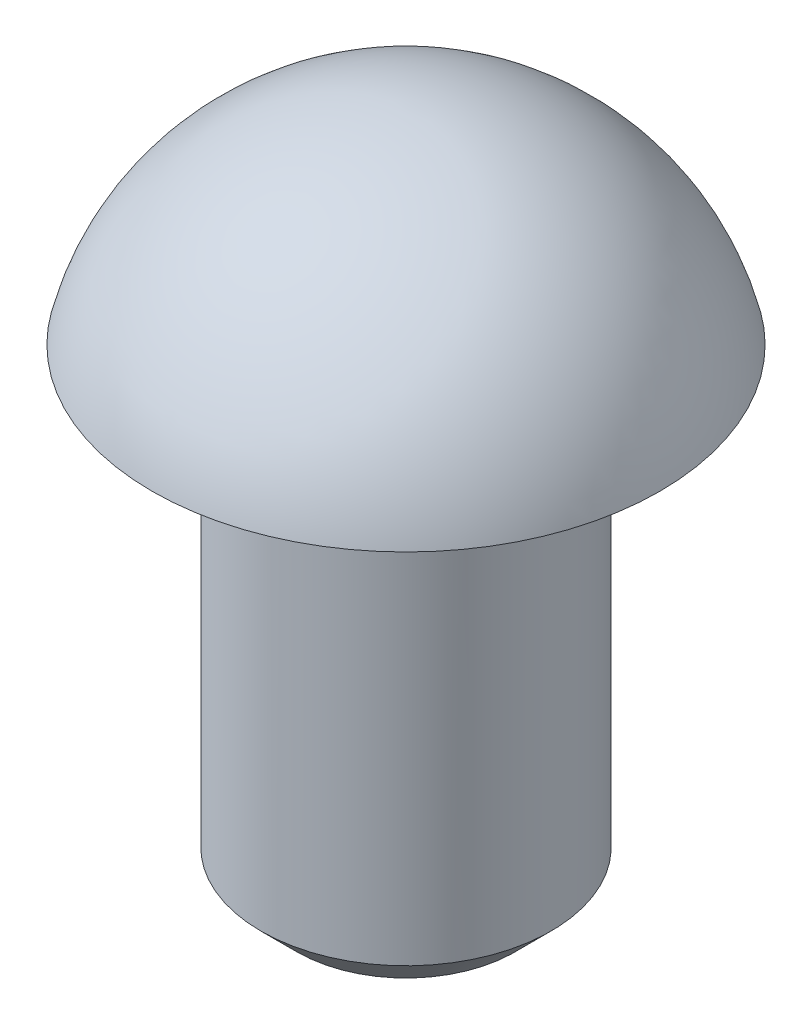
from build123d import *

# Parameters (mm, degrees)
SKETCH1_R           = 2
BOSS_EXTRUDE1_DEPTH = 3.25
CHAMFER1_SIZE       = 0.5


with BuildPart() as part:
    # Sketch1 → Boss-Extrude1 (new, symmetric)
    with BuildSketch(Plane(origin=(0, 0, 0), x_dir=(1, 0, 0), z_dir=(0, 1, 0))):
        with Locations(Location((0, 0, 0), (0, 0, 90))):
            Circle(SKETCH1_R)
    extrude(amount=BOSS_EXTRUDE1_DEPTH, both=True)

    # Chamfer1
    chamfer1_edges = [part.edges().sort_by_distance(p)[0] for p in [
        (0, -3.25, 2),
    ]]
    chamfer(chamfer1_edges, length=CHAMFER1_SIZE)

    # Sketch2 → Revolve1 (revolve)
    with BuildSketch(Plane(origin=(0, 0, 0), x_dir=(0, 0, -1), z_dir=(1, 0, 0))):
        with BuildLine():
            Line((0, 3.25), (-3.5, 3.25))
            ThreePointArc((-3.5, 3.25), (-2.227844932, 5.235229955), (0, 6.007385023))
            Line((0, 6.007385023), (0, 3.25))
        make_face()
    revolve(axis=Axis((0, 1.850797084, 0), (0, 1, 0)))


solid = part.part
